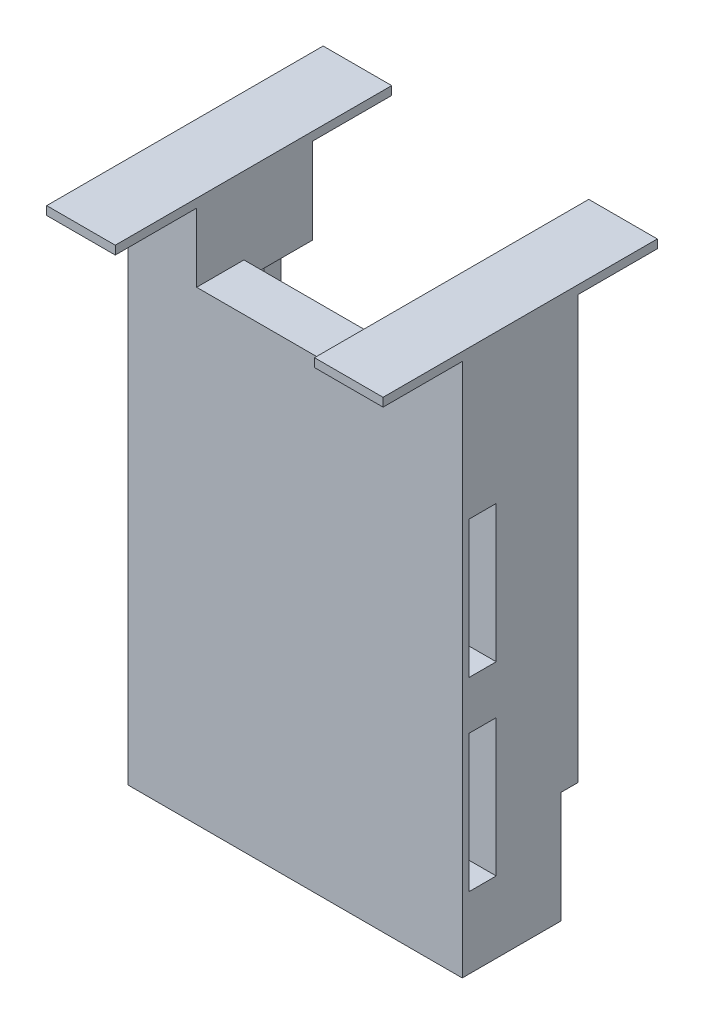
from build123d import *

# Parameters (mm, degrees)
BOSS_EXTRUDE1_DEPTH = 83.0326
SKETCH6_W           = 61.8998
SKETCH6_H           = 21.463
BOSS_EXTRUDE3_DEPTH = 3.175
SKETCH7_W           = 16.5354
SKETCH7_H           = 9.525
CUT_EXTRUDE2_DEPTH  = 91.420129415
SKETCH8_W           = 5.08
SKETCH8_H           = 25.4
CUT_EXTRUDE3_DEPTH  = 108.64212172
SKETCH15_W          = 61.8998
SKETCH15_H          = 20.63242
CUT_EXTRUDE4_DEPTH  = 3.175
SKETCH16_W          = 36.4998
SKETCH16_H          = 12.7
CUT_EXTRUDE5_DEPTH  = 3.175
SKETCH17_W          = 12.7
SKETCH17_H          = 21.463
BOSS_EXTRUDE4_DEPTH = 12.7
SKETCH18_W          = 12.7
SKETCH18_H          = 50.8
BOSS_EXTRUDE5_DEPTH = 1.5875
SKETCH19_W          = 12.7
SKETCH19_H          = 51.208048645
BOSS_EXTRUDE6_DEPTH = 1.5875


with BuildPart() as part:
    # Sketch1 → Boss-Extrude1 (new body)
    with BuildSketch(Plane(origin=(0, 0, 0), x_dir=(1, 0, 0), z_dir=(0, 1, 0))):
        Polygon((-30.9499, -3.477149156), (30.9499, -3.477149156), (30.9499, 17.985850844), (24.0411, 17.985850844), (24.0411, 14.810850844), (27.7749, 14.810850844), (27.7749, 5.285850844), (-27.7749, 5.285850844), (-27.7749, 14.810850844), (-24.0411, 14.810850844), (-24.0411, 17.985850844), (-30.9499, 17.985850844), align=None)
    extrude(amount=BOSS_EXTRUDE1_DEPTH)

    # Sketch6 → Boss-Extrude3 (add)
    with BuildSketch(Plane(origin=(0, 83.0326, 0), x_dir=(1, 0, 0), z_dir=(0, 1, 0))):
        with Locations((0, 7.254350844)):
            Rectangle(SKETCH6_W, SKETCH6_H)
    extrude(amount=BOSS_EXTRUDE3_DEPTH)

    # Sketch7 → Cut-Extrude2 (cut, through all)
    with BuildSketch(Plane.XZ.offset(-83.0326)):
        with Locations((0, -10.048350844)):
            Rectangle(SKETCH7_W, SKETCH7_H)
    extrude(amount=-CUT_EXTRUDE2_DEPTH, mode=Mode.SUBTRACT)

    # Sketch8 → Cut-Extrude3 (cut, through all)
    with BuildSketch(Plane.ZY.offset(30.9499)):
        with Locations((-0.274453158, 60.28364576)):
            Rectangle(SKETCH8_W, SKETCH8_H)
        with Locations((-0.274453158, 25.92395424)):
            Rectangle(SKETCH8_W, SKETCH8_H)
    extrude(amount=-CUT_EXTRUDE3_DEPTH, mode=Mode.SUBTRACT)

    # Sketch15 → Cut-Extrude4 (cut)
    with BuildSketch(Plane(origin=(0, 0, -17.985850844), x_dir=(-1, 0, 0), z_dir=(0, 0, -1))):
        with Locations((0, 10.31621)):
            Rectangle(SKETCH15_W, SKETCH15_H)
    extrude(amount=-CUT_EXTRUDE4_DEPTH, mode=Mode.SUBTRACT)

    # Sketch16 → Cut-Extrude5 (cut)
    with BuildSketch(Plane(origin=(0, 86.2076, 0), x_dir=(1, 0, 0), z_dir=(0, 1, 0))):
        with Locations((0, 11.635850844)):
            Rectangle(SKETCH16_W, SKETCH16_H)
    extrude(amount=-CUT_EXTRUDE5_DEPTH, mode=Mode.SUBTRACT)

    # Sketch17 → Boss-Extrude4 (add)
    with BuildSketch(Plane(origin=(0, 86.2076, 0), x_dir=(1, 0, 0), z_dir=(0, 1, 0))):
        with Locations((-24.5999, 7.254350844)):
            Rectangle(SKETCH17_W, SKETCH17_H)
        with Locations((24.5999, 7.254350844)):
            Rectangle(SKETCH17_W, SKETCH17_H)
    extrude(amount=BOSS_EXTRUDE4_DEPTH)

    # Sketch18 → Boss-Extrude5 (add)
    with BuildSketch(Plane(origin=(0, 98.9076, 0), x_dir=(1, 0, 0), z_dir=(0, 1, 0))):
        with Locations((24.5999, 7.254350844)):
            Rectangle(SKETCH18_W, SKETCH18_H)
    extrude(amount=BOSS_EXTRUDE5_DEPTH)

    # Sketch19 → Boss-Extrude6 (add)
    with BuildSketch(Plane(origin=(0, 98.9076, 0), x_dir=(1, 0, 0), z_dir=(0, 1, 0))):
        with Locations((-24.5999, 7.050326521)):
            Rectangle(SKETCH19_W, SKETCH19_H)
    extrude(amount=BOSS_EXTRUDE6_DEPTH)


solid = part.part
